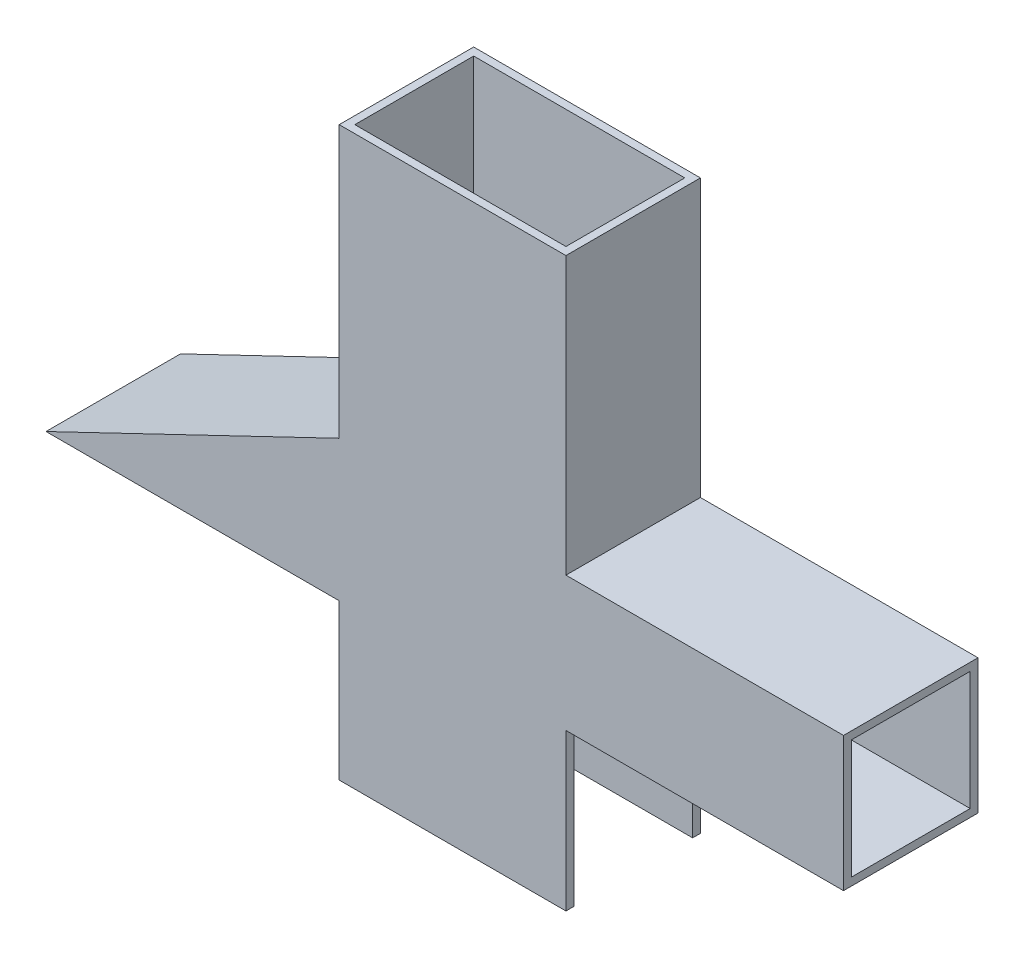
from build123d import *

# Parameters (mm, degrees)
ESQUISSE1_W             = 145
ESQUISSE1_H             = 86
ESQUISSE1_W_2           = 135
ESQUISSE1_H_2           = 76
BOSS_EXTRU_1_DEPTH      = 258
ESQUISSE2_W             = 145
ESQUISSE2_H             = 86
BOSS_EXTRU_2_DEPTH      = 5
ESQUISSE3_W             = 30
ESQUISSE3_H             = 76
ENL_V_MAT_EXTRU_1_DEPTH = 5
ESQUISSE5_W             = 5
ESQUISSE5_H             = 86
BOSS_EXTRU_3_DEPTH      = 100
BOSS_EXTRU_6_DEPTH      = 86
ESQUISSE10_W            = 86
ESQUISSE10_H            = 86
ESQUISSE10_W_2          = 76
ESQUISSE10_H_2          = 76
BOSS_EXTRU_7_DEPTH      = 177.5
ESQUISSE11_W            = 76
ESQUISSE11_H            = 76
ENL_V_MAT_EXTRU_2_DEPTH = 10
ESQUISSE12_W            = 140
ESQUISSE12_H            = 5
BOSS_EXTRU_8_DEPTH      = 100


with BuildPart() as part:
    # Esquisse1 → Boss.-Extru.1 (new body)
    with BuildSketch(Plane(origin=(0, 0, 0), x_dir=(1, 0, 0), z_dir=(0, 1, 0))):
        with Locations((34.799005462, -27.04875873)):
            Rectangle(ESQUISSE1_W, ESQUISSE1_H)
        with Locations((34.799005462, -27.04875873)):
            Rectangle(ESQUISSE1_W_2, ESQUISSE1_H_2, mode=Mode.SUBTRACT)
    extrude(amount=BOSS_EXTRU_1_DEPTH)

    # Esquisse2 → Boss.-Extru.2 (add)
    with BuildSketch(Plane.XZ):
        with Locations((34.799005462, 27.04875873)):
            Rectangle(ESQUISSE2_W, ESQUISSE2_H)
    extrude(amount=BOSS_EXTRU_2_DEPTH)

    # Esquisse3 → Enlèv. mat.-Extru.1 (cut)
    with BuildSketch(Plane.XZ.offset(5)):
        with Locations((-17.700994538, 27.04875873)):
            Rectangle(ESQUISSE3_W, ESQUISSE3_H)
    extrude(amount=-ENL_V_MAT_EXTRU_1_DEPTH, mode=Mode.SUBTRACT)

    # Esquisse5 → Boss.-Extru.3 (add)
    with BuildSketch(Plane.XZ.offset(5)):
        with Locations((-35.200994538, 27.04875873)):
            Rectangle(ESQUISSE5_W, ESQUISSE5_H)
    extrude(amount=BOSS_EXTRU_3_DEPTH)

    # Esquisse9 → Boss.-Extru.6 (add)
    with BuildSketch(Plane.XY.offset(70.04875873)):
        Polygon((-37.700994538, -5.700514768), (-37.700994538, 84.299485232), (-225.200994538, -5.700514768), align=None)
    extrude(amount=-BOSS_EXTRU_6_DEPTH)

    # Esquisse10 → Boss.-Extru.7 (add)
    with BuildSketch(Plane(origin=(107.299005462, 0, 0), x_dir=(0, 0, -1), z_dir=(1, 0, 0))):
        with Locations((-27.04875873, 38)):
            Rectangle(ESQUISSE10_W, ESQUISSE10_H)
        with Locations((-27.04875873, 38)):
            Rectangle(ESQUISSE10_W_2, ESQUISSE10_H_2, mode=Mode.SUBTRACT)
    extrude(amount=BOSS_EXTRU_7_DEPTH)

    # Esquisse11 → Enlèv. mat.-Extru.2 (cut)
    with BuildSketch(Plane(origin=(107.299005462, 0, 0), x_dir=(0, 0, -1), z_dir=(1, 0, 0))):
        with Locations((-27.04875873, 38)):
            Rectangle(ESQUISSE11_W, ESQUISSE11_H)
    extrude(amount=-ENL_V_MAT_EXTRU_2_DEPTH, mode=Mode.SUBTRACT)

    # Esquisse12 → Boss.-Extru.8 (add)
    with BuildSketch(Plane.XZ.offset(5)):
        with Locations((37.299005462, 67.54875873)):
            Rectangle(ESQUISSE12_W, ESQUISSE12_H)
        with Locations((37.299005462, -13.45124127)):
            Rectangle(ESQUISSE12_W, ESQUISSE12_H)
    extrude(amount=BOSS_EXTRU_8_DEPTH)


solid = part.part
